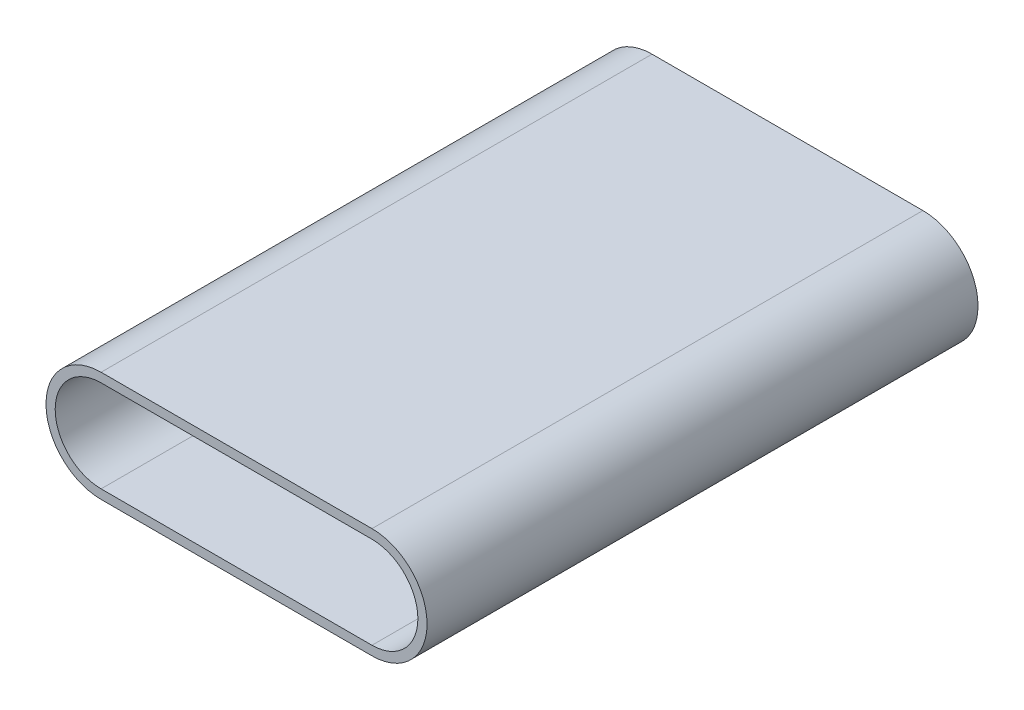
from build123d import *

# Parameters (mm, degrees)
USBCPROFILE_DEPTH = 6


with BuildPart() as part:
    # USBCProfileS → USBCProfile (new, symmetric)
    with BuildSketch(Plane.XY):
        with BuildLine():
            Line((-2.95, 1.2), (2.95, 1.2))
            ThreePointArc((2.95, 1.2), (4.15, 0), (2.95, -1.2))
            Line((2.95, -1.2), (-2.95, -1.2))
            ThreePointArc((-2.95, -1.2), (-4.15, 0), (-2.95, 1.2))
        make_face()
        with BuildLine():
            Line((-2.95, 1), (2.95, 1))
            ThreePointArc((2.95, 1), (3.95, 0), (2.95, -1))
            Line((2.95, -1), (-2.95, -1))
            ThreePointArc((-2.95, -1), (-3.95, 0), (-2.95, 1))
        make_face(mode=Mode.SUBTRACT)
    extrude(amount=USBCPROFILE_DEPTH, both=True)


solid = part.part
